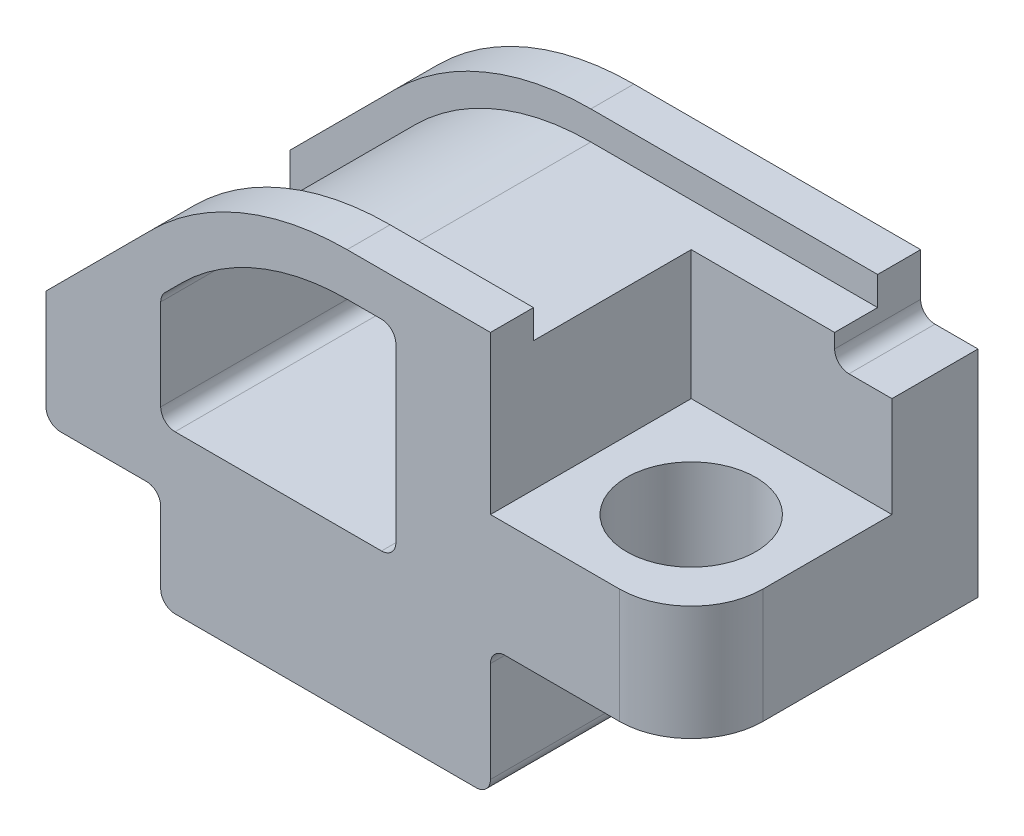
from build123d import *

# Parameters (mm, degrees)
BOSS_EXTRUDE1_DEPTH     = 50
CUT_EXTRUDE1_DEPTH      = 232.570723538
CUT_EXTRUDE1_DEPTH_BACK = 232.570723538
SKETCH3_W               = 70
SKETCH3_H               = 70
CUT_EXTRUDE2_DEPTH      = 55
SKETCH4_R               = 22.5
CUT_EXTRUDE3_DEPTH      = 184.711730709
CUT_EXTRUDE4_DEPTH      = 35
FILLET1_R               = 5
FILLET2_R               = 5


with BuildPart() as part:
    # Sketch1 → Boss-Extrude1 (new, symmetric)
    with BuildSketch(Plane.XY):
        with BuildLine():
            Line((0, 0), (-115, 0))
            Line((-115, 0), (-115, 35))
            Line((-115, 35), (-155, 35))
            Line((-155, 35), (-155, 75))
            Line((-155, 75), (-118.284271247, 111.715728753))
            ThreePointArc((-118.284271247, 111.715728753), (-86.9551813, 132.649157401), (-50, 140))
            Line((-50, 140), (50, 140))
            Line((50, 140), (50, 120))
            Line((50, 120), (70, 120))
            Line((70, 120), (70, 45))
            Line((70, 45), (0, 45))
            Line((0, 45), (0, 0))
        make_face()
    extrude(amount=BOSS_EXTRUDE1_DEPTH, both=True)

    # Sketch2 → Cut-Extrude1 (cut, two sides: drawn at the far end of the back side and taken through both)
    with BuildSketch(Plane.XY.offset(50).offset(-CUT_EXTRUDE1_DEPTH_BACK)):
        with BuildLine():
            Line((-33, 55), (-33, 125))
            Line((-33, 125), (-50, 125))
            ThreePointArc((-50, 125), (-81.214929815, 118.790964413), (-107.67766953, 101.109127035))
            Line((-107.67766953, 101.109127035), (-115, 93.786796564))
            Line((-115, 93.786796564), (-115, 55))
            Line((-115, 55), (-33, 55))
        make_face()
    extrude(amount=CUT_EXTRUDE1_DEPTH + CUT_EXTRUDE1_DEPTH_BACK, mode=Mode.SUBTRACT)

    # Sketch3 → Cut-Extrude2 (cut)
    with BuildSketch(Plane(origin=(0, 140, 0), x_dir=(1, 0, 0), z_dir=(0, 1, 0))):
        with Locations((35, -15)):
            Rectangle(SKETCH3_W, SKETCH3_H)
    extrude(amount=-CUT_EXTRUDE2_DEPTH, mode=Mode.SUBTRACT)

    # Sketch4 → Cut-Extrude3 (cut, through all)
    with BuildSketch(Plane(origin=(0, 85, 0), x_dir=(1, 0, 0), z_dir=(0, 1, 0))):
        with Locations(Location((35, -15, 0), (0, 0, 180))):
            Circle(SKETCH4_R)
        with BuildLine():
            Line((70, -25), (70, -50))
            Line((70, -50), (45, -50))
            ThreePointArc((45, -50), (62.67766953, -42.67766953), (70, -25))
        make_face()
    extrude(amount=-CUT_EXTRUDE3_DEPTH, mode=Mode.SUBTRACT)

    # Sketch5 → Cut-Extrude4 (cut, symmetric)
    with BuildSketch(Plane.XY):
        with BuildLine():
            Line((-111.213203436, 104.644660941), (-155, 60.857864376))
            Line((-155, 60.857864376), (-155, 75))
            Line((-155, 75), (-118.284271247, 111.715728753))
            ThreePointArc((-118.284271247, 111.715728753), (-86.9551813, 132.649157401), (-50, 140))
            Line((-50, 140), (0, 140))
            Line((0, 140), (50, 140))
            Line((50, 140), (50, 130))
            Line((50, 130), (0, 130))
            Line((0, 130), (-50, 130))
            ThreePointArc((-50, 130), (-83.128346977, 123.410362075), (-111.213203436, 104.644660941))
        make_face()
    extrude(amount=CUT_EXTRUDE4_DEPTH, both=True, mode=Mode.SUBTRACT)

    # Fillet1
    fillet1_edges = [part.edges().sort_by_distance(p)[0] for p in [
        (-115, 93.786796564, 0),
        (-33, 125, 0),
        (-33, 55, 0),
        (-115, 55, 0),
    ]]
    fillet(fillet1_edges, radius=FILLET1_R)

    # Fillet2
    fillet2_edges = [part.edges().sort_by_distance(p)[0] for p in [
        (0, 0, 0),
        (-115, 0, 0),
        (-115, 35, 0),
        (-155, 35, 0),
        (0, 45, 0),
        (50, 120, -35),
    ]]
    fillet(fillet2_edges, radius=FILLET2_R)


solid = part.part
